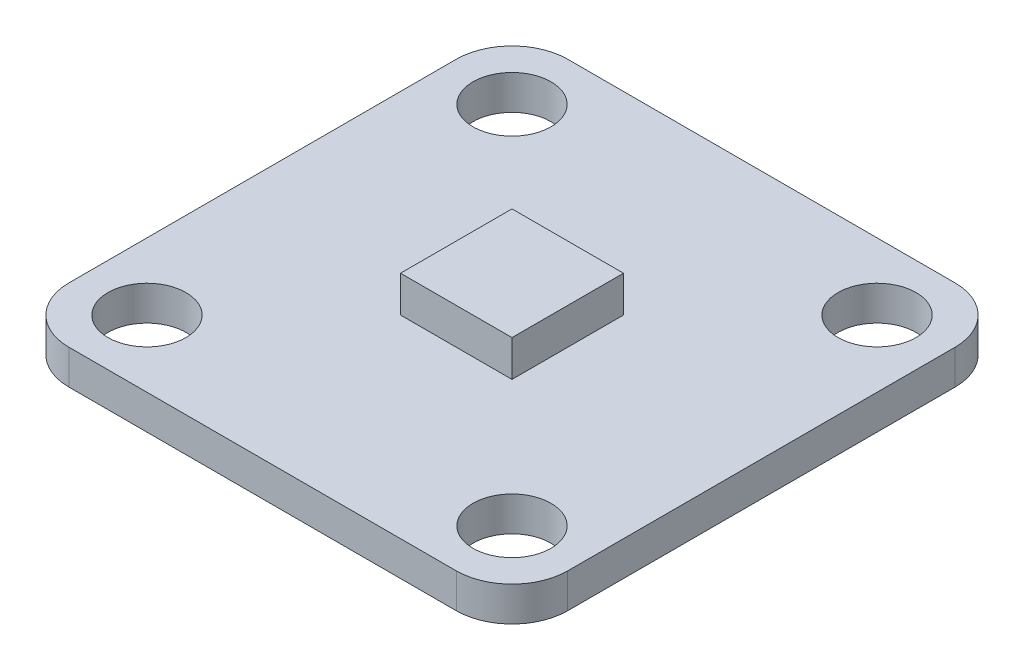
from build123d import *

# Parameters (mm, degrees)
SKETCH1_W           = 22.733
SKETCH1_H           = 22.733
BOSS_EXTRUDE1_DEPTH = 1.5748
FILLET1_R           = 2.54
SKETCH2_R           = 1.778
CUT_EXTRUDE1_DEPTH  = 1.5748
SKETCH3_W           = 5.08
SKETCH3_H           = 5.08
BOSS_EXTRUDE2_DEPTH = 1.651


with BuildPart() as part:
    # Sketch1 → Boss-Extrude1 (new body)
    with BuildSketch(Plane.XZ.offset(-26.884)):
        with Locations((11.43, 0)):
            Rectangle(SKETCH1_W, SKETCH1_H)
    extrude(amount=BOSS_EXTRUDE1_DEPTH)

    # Fillet1
    fillet1_edges = [part.edges().sort_by_distance(p)[0] for p in [
        (0.0635, 26.0966, 11.3665),
        (22.7965, 26.0966, 11.3665),
        (22.7965, 26.0966, -11.3665),
        (0.0635, 26.0966, -11.3665),
    ]]
    fillet(fillet1_edges, radius=FILLET1_R)

    # Sketch2 → Cut-Extrude1 (cut)
    with BuildSketch(Plane(origin=(0, 26.884, 0), x_dir=(1, 0, 0), z_dir=(0, 1, 0))):
        with Locations(Location((19.7485, 8.3185, 0), (0, 0, 270))):
            Circle(SKETCH2_R)
        with Locations(Location((3.1115, 8.3185, 0), (0, 0, 90))):
            Circle(SKETCH2_R)
        with Locations(Location((19.7485, -8.3185, 0), (0, 0, 90))):
            Circle(SKETCH2_R)
        with Locations(Location((3.1115, -8.3185, 0), (0, 0, 270))):
            Circle(SKETCH2_R)
    extrude(amount=-CUT_EXTRUDE1_DEPTH, mode=Mode.SUBTRACT)

    # Sketch3 → Boss-Extrude2 (add)
    with BuildSketch(Plane(origin=(0, 26.884, 0), x_dir=(1, 0, 0), z_dir=(0, 1, 0))):
        with Locations((11.43, 0)):
            Rectangle(SKETCH3_W, SKETCH3_H)
    extrude(amount=BOSS_EXTRUDE2_DEPTH)


solid = part.part
